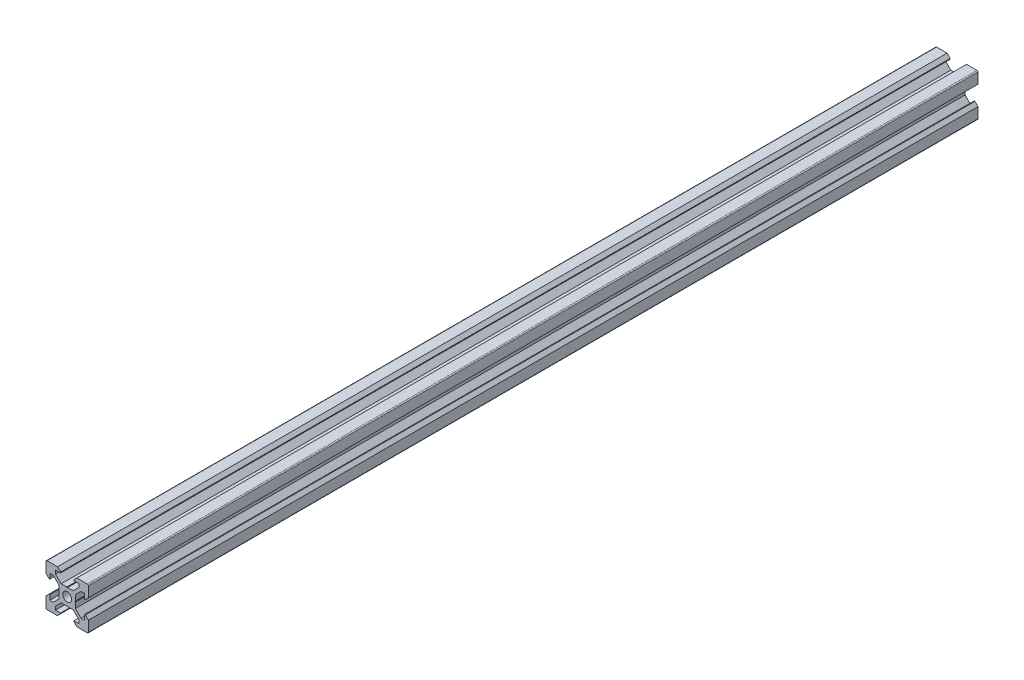
from build123d import *

# Parameters (mm, degrees)
SKETCH1_R           = 2.1
BOSS_EXTRUDE1_DEPTH = 210


with BuildPart() as part:
    # Sketch1 → Boss-Extrude1 (new, symmetric)
    with BuildSketch(Plane.XY):
        with BuildLine():
            Line((4.58, -10), (9.5, -10))
            ThreePointArc((9.5, -10), (9.853553391, -9.853553391), (10, -9.5))
            Line((10, -9.5), (10, -4.58))
            Line((10, -4.58), (8.545, -3.125))
            Line((8.545, -3.125), (8.2, -3.125))
            Line((8.2, -3.125), (8.2, -5.5))
            Line((8.2, -5.5), (6.560660172, -5.5))
            Line((6.560660172, -5.5), (3.9, -2.839339828))
            Line((3.9, -2.839339828), (3.9, -0.21))
            Line((3.9, -0.21), (3.69, 0))
            Line((3.69, 0), (3.9, 0.21))
            Line((3.9, 0.21), (3.9, 2.839339828))
            Line((3.9, 2.839339828), (6.560660172, 5.5))
            Line((6.560660172, 5.5), (8.2, 5.5))
            Line((8.2, 5.5), (8.2, 3.125))
            Line((8.2, 3.125), (8.545, 3.125))
            Line((8.545, 3.125), (10, 4.58))
            Line((10, 4.58), (10, 9.5))
            ThreePointArc((10, 9.5), (9.853553391, 9.853553391), (9.5, 10))
            Line((9.5, 10), (4.58, 10))
            Line((4.58, 10), (3.125, 8.545))
            Line((3.125, 8.545), (3.125, 8.2))
            Line((3.125, 8.2), (5.5, 8.2))
            Line((5.5, 8.2), (5.5, 6.560660172))
            Line((5.5, 6.560660172), (2.839339828, 3.9))
            Line((2.839339828, 3.9), (0.21, 3.9))
            Line((0.21, 3.9), (0, 3.69))
            Line((0, 3.69), (-0.21, 3.9))
            Line((-0.21, 3.9), (-2.839339828, 3.9))
            Line((-2.839339828, 3.9), (-5.5, 6.560660172))
            Line((-5.5, 6.560660172), (-5.5, 8.2))
            Line((-5.5, 8.2), (-3.125, 8.2))
            Line((-3.125, 8.2), (-3.125, 8.545))
            Line((-3.125, 8.545), (-4.58, 10))
            Line((-4.58, 10), (-9.5, 10))
            ThreePointArc((-9.5, 10), (-9.853553391, 9.853553391), (-10, 9.5))
            Line((-10, 9.5), (-10, 4.58))
            Line((-10, 4.58), (-8.545, 3.125))
            Line((-8.545, 3.125), (-8.2, 3.125))
            Line((-8.2, 3.125), (-8.2, 5.5))
            Line((-8.2, 5.5), (-6.560660172, 5.5))
            Line((-6.560660172, 5.5), (-3.9, 2.839339828))
            Line((-3.9, 2.839339828), (-3.9, 0.21))
            Line((-3.9, 0.21), (-3.69, 0))
            Line((-3.69, 0), (-3.9, -0.21))
            Line((-3.9, -0.21), (-3.9, -2.839339828))
            Line((-3.9, -2.839339828), (-6.560660172, -5.5))
            Line((-6.560660172, -5.5), (-8.2, -5.5))
            Line((-8.2, -5.5), (-8.2, -3.125))
            Line((-8.2, -3.125), (-8.545, -3.125))
            Line((-8.545, -3.125), (-10, -4.58))
            Line((-10, -4.58), (-10, -9.5))
            ThreePointArc((-10, -9.5), (-9.853553391, -9.853553391), (-9.5, -10))
            Line((-9.5, -10), (-4.58, -10))
            Line((-4.58, -10), (-3.125, -8.545))
            Line((-3.125, -8.545), (-3.125, -8.2))
            Line((-3.125, -8.2), (-5.5, -8.2))
            Line((-5.5, -8.2), (-5.5, -6.560660172))
            Line((-5.5, -6.560660172), (-2.839339828, -3.9))
            Line((-2.839339828, -3.9), (-0.21, -3.9))
            Line((-0.21, -3.9), (0, -3.69))
            Line((0, -3.69), (0.21, -3.9))
            Line((0.21, -3.9), (2.839339828, -3.9))
            Line((2.839339828, -3.9), (5.5, -6.560660172))
            Line((5.5, -6.560660172), (5.5, -8.2))
            Line((5.5, -8.2), (3.125, -8.2))
            Line((3.125, -8.2), (3.125, -8.545))
            Line((3.125, -8.545), (4.58, -10))
        make_face()
        Circle(SKETCH1_R, mode=Mode.SUBTRACT)
    extrude(amount=BOSS_EXTRUDE1_DEPTH, both=True)


solid = part.part
